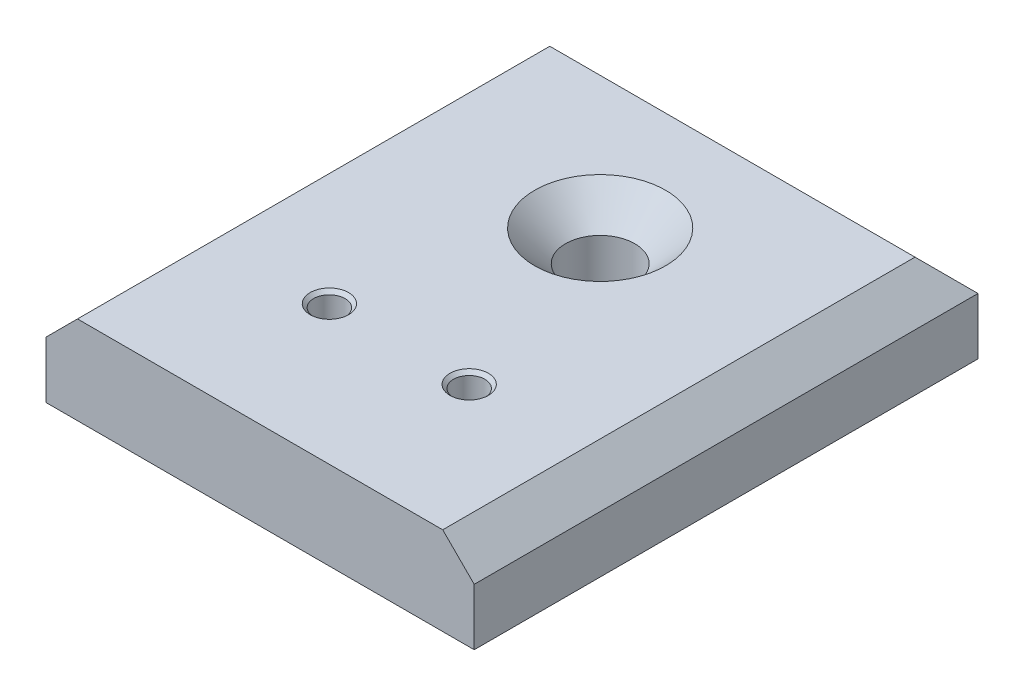
from build123d import *

# Parameters (mm, degrees)
SKETCH_1_W                    = 34
SKETCH_1_H                    = 40
EXTRUDE_293_DEPTH             = 7
HOLE_WIZARD_40_M5_D           = 5.5
HOLE_WIZARD_40_M5_CSINK_D     = 10.4
HOLE_WIZARD_40_M5_CSINK_ANGLE = 90
HOLE_WIZARD_1147_D            = 2.5
HOLE_WIZARD_1147_CSINK_D      = 3.05
HOLE_WIZARD_1147_CSINK_ANGLE  = 90
CHAMFER_1_SIZE                = 2.5


with BuildPart() as part:
    # Эскиз1 → Extrude 293 (new body)
    with BuildSketch(Plane(origin=(0, 0, 0), x_dir=(1, 0, 0), z_dir=(0, 1, 0))):
        Rectangle(SKETCH_1_W, SKETCH_1_H)
    extrude(amount=EXTRUDE_293_DEPTH)

    # Крепление к профилю 40 - M5 (through all)
    with Locations(Plane(origin=(0, 7, 0), x_dir=(-1, 0, 0), z_dir=(0, 1, 0))):
        with Locations((0, -7)):
            CounterSinkHole(HOLE_WIZARD_40_M5_D / 2, HOLE_WIZARD_40_M5_CSINK_D / 2, counter_sink_angle=HOLE_WIZARD_40_M5_CSINK_ANGLE)

    # Hole Wizard 1147 (through all)
    with Locations(Plane(origin=(0, 7, 0), x_dir=(-1, 0, 0), z_dir=(0, 1, 0))):
        with Locations((5.55, 8.95), (-5.55, 8.95)):
            CounterSinkHole(HOLE_WIZARD_1147_D / 2, HOLE_WIZARD_1147_CSINK_D / 2, counter_sink_angle=HOLE_WIZARD_1147_CSINK_ANGLE)

    # Фаска1
    chamfer_1_edges = [part.edges().sort_by_distance(p)[0] for p in [
        (-17, 7, 0),
        (17, 7, 0),
        (0, 7, -20),
    ]]
    chamfer(chamfer_1_edges, length=CHAMFER_1_SIZE)


solid = part.part
